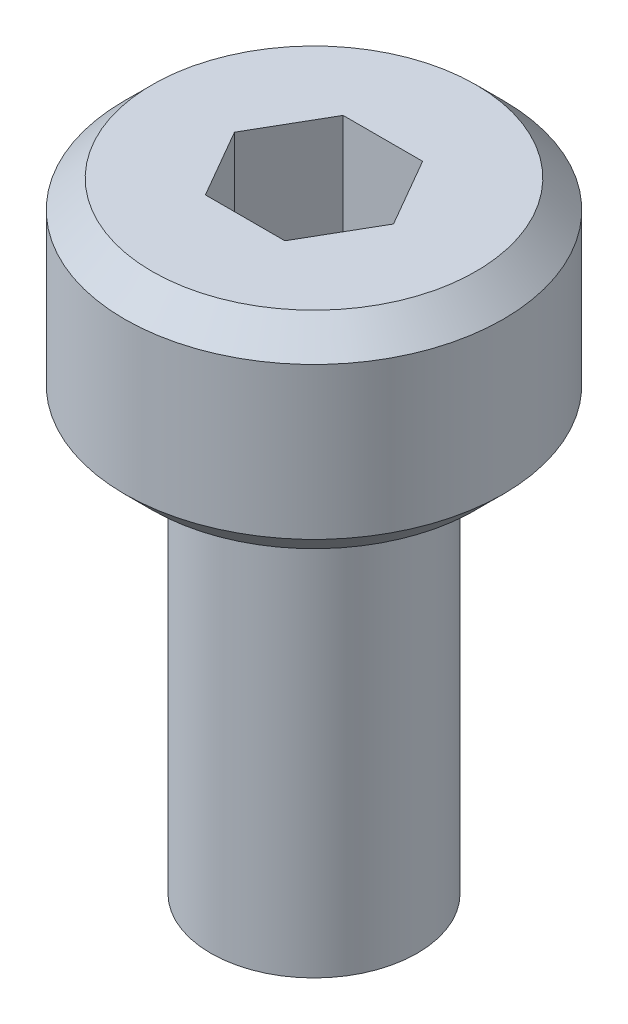
from build123d import *

# Parameters (mm, degrees)
CHAMFER1_SIZE      = 0.4
CUT_EXTRUDE1_DEPTH = 4


with BuildPart() as part:
    # Sketch1 → Revolve3 (revolve)
    with BuildSketch(Plane.XY, mode=Mode.PRIVATE) as revolve3_sk:
        Polygon((0, 9), (2.75, 9), (2.75, 6), (1.5, 6), (1.5, 0), (0, 0), align=None)
    revolve(revolve3_sk.sketch.rotate(Axis((0, 0, 0), (0, 1, 0)), 90), axis=Axis((0, 0, 0), (0, 1, 0)))

    # Chamfer1
    chamfer1_edges = [part.edges().sort_by_distance(p)[0] for p in [
        (0, 6, 2.75),
        (0, 9, 2.75),
    ]]
    chamfer(chamfer1_edges, length=CHAMFER1_SIZE)

    # Sketch2 → Cut-Extrude1 (cut)
    with BuildSketch(Plane(origin=(0, 9, 0), x_dir=(1, 0, 0), z_dir=(0, 1, 0))):
        Polygon((0.577350269, -1), (1.154700538, 0), (0.577350269, 1), (-0.577350269, 1), (-1.154700538, 0), (-0.577350269, -1), align=None)
    extrude(amount=-CUT_EXTRUDE1_DEPTH, mode=Mode.SUBTRACT)


solid = part.part
